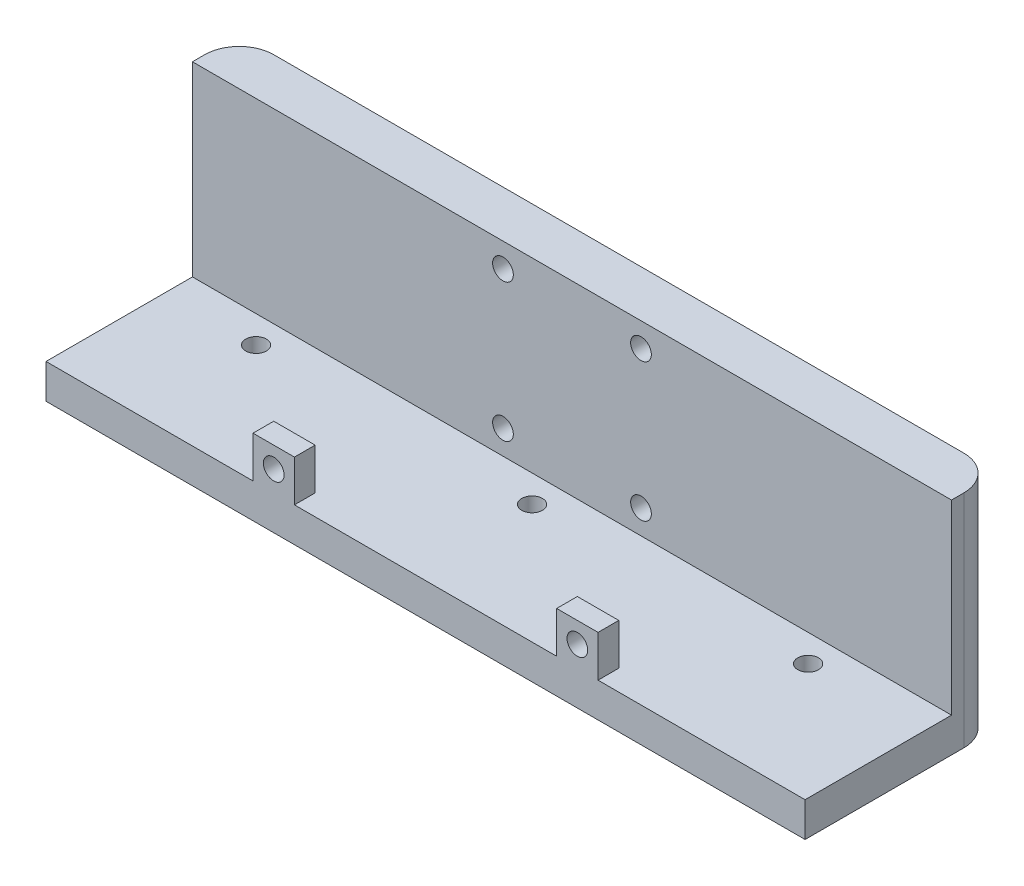
from build123d import *

# Parameters (mm, degrees)
SKETCH1_W           = 110
SKETCH1_H           = 28
BOSS_EXTRUDE1_DEPTH = 5
SKETCH2_W           = 110
SKETCH2_H           = 32
BOSS_EXTRUDE2_DEPTH = 6.78
SKETCH3_R           = 1.5
CUT_EXTRUDE1_DEPTH  = 117.674761624
SKETCH4_R           = 1.5
CUT_EXTRUDE2_DEPTH  = 117.508748169
FILLET1_R           = 5
SKETCH5_W           = 6
SKETCH5_H           = 3
BOSS_EXTRUDE3_DEPTH = 6
SKETCH6_R           = 1.5
CUT_EXTRUDE3_DEPTH  = 6


with BuildPart() as part:
    # Sketch1 → Boss-Extrude1 (new body)
    with BuildSketch(Plane(origin=(0, 0, 0), x_dir=(1, 0, 0), z_dir=(0, 1, 0))):
        with Locations((55, 14)):
            Rectangle(SKETCH1_W, SKETCH1_H)
    extrude(amount=BOSS_EXTRUDE1_DEPTH)

    # Sketch2 → Boss-Extrude2 (add)
    with BuildSketch(Plane(origin=(0, 0, -28), x_dir=(-1, 0, 0), z_dir=(0, 0, -1))):
        with Locations((-55, 16)):
            Rectangle(SKETCH2_W, SKETCH2_H)
    extrude(amount=-BOSS_EXTRUDE2_DEPTH)

    # Sketch3 → Cut-Extrude1 (cut, through all)
    with BuildSketch(Plane(origin=(0, 5, 0), x_dir=(-1, 0, 0), z_dir=(0, 1, 0))):
        with Locations(Location((-13.16, -17.28, 0), (0, 0, 90))):
            Circle(SKETCH3_R)
        with Locations(Location((-53.16, -17.28, 0), (0, 0, 90))):
            Circle(SKETCH3_R)
        with Locations(Location((-93.16, -17.28, 0), (0, 0, 90))):
            Circle(SKETCH3_R)
    extrude(amount=-CUT_EXTRUDE1_DEPTH, mode=Mode.SUBTRACT)

    # Sketch4 → Cut-Extrude2 (cut, through all)
    with BuildSketch(Plane.XY.offset(-21.22)):
        with Locations((45, 8.5)):
            Circle(SKETCH4_R)
        with Locations((65, 8.5)):
            Circle(SKETCH4_R)
        with Locations((45, 28.5)):
            Circle(SKETCH4_R)
        with Locations((65, 28.5)):
            Circle(SKETCH4_R)
    extrude(amount=-CUT_EXTRUDE2_DEPTH, mode=Mode.SUBTRACT)

    # Fillet1
    fillet1_edges = [part.edges().sort_by_distance(p)[0] for p in [
        (0, 16, -28),
        (110, 16, -28),
    ]]
    fillet(fillet1_edges, radius=FILLET1_R)

    # Sketch5 → Boss-Extrude3 (add)
    with BuildSketch(Plane(origin=(0, 5, 0), x_dir=(-1, 0, 0), z_dir=(0, 1, 0))):
        with Locations((-33, -1.5)):
            Rectangle(SKETCH5_W, SKETCH5_H)
        with Locations((-77, -1.5)):
            Rectangle(SKETCH5_W, SKETCH5_H)
    extrude(amount=BOSS_EXTRUDE3_DEPTH)

    # Sketch6 → Cut-Extrude3 (cut)
    with BuildSketch(Plane.XY):
        with Locations((33, 8)):
            Circle(SKETCH6_R)
        with Locations((77, 8)):
            Circle(SKETCH6_R)
    extrude(amount=-CUT_EXTRUDE3_DEPTH, mode=Mode.SUBTRACT)


solid = part.part
